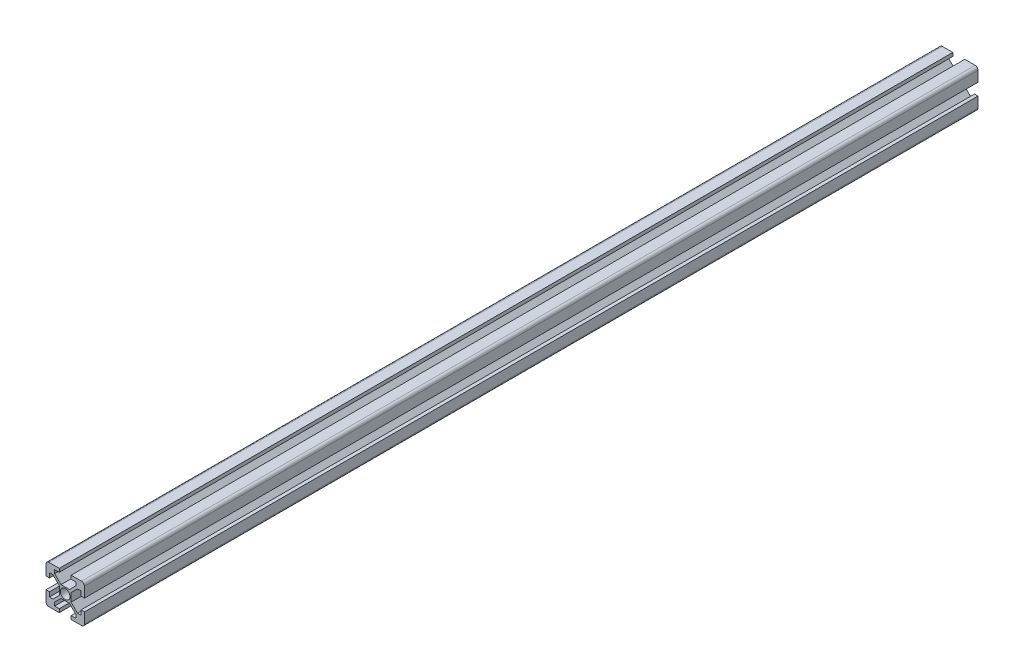
from build123d import *

# Parameters (mm, degrees)
SKETCH_1_R      = 2.5
EXTRUDE_1_DEPTH = 465


with BuildPart() as part:
    # 草图1 → 凸台-拉伸1 (new body)
    with BuildSketch(Plane.XY):
        with BuildLine():
            Line((-8.2, -3.1), (-10, -3.1))
            Line((-10, -3.1), (-10, -8.5))
            ThreePointArc((-10, -8.5), (-9.560660172, -9.560660172), (-8.5, -10))
            Line((-8.5, -10), (-3.1, -10))
            Line((-3.1, -10), (-3.1, -8.2))
            Line((-3.1, -8.2), (-5.5, -8.2))
            Line((-5.5, -8.2), (-5.5, -6.397050155))
            Line((-5.5, -6.397050155), (-2.202949845, -3.1))
            Line((-2.202949845, -3.1), (2.202949845, -3.1))
            Line((2.202949845, -3.1), (5.5, -6.397050155))
            Line((5.5, -6.397050155), (5.5, -8.2))
            Line((5.5, -8.2), (3.1, -8.2))
            Line((3.1, -8.2), (3.1, -10))
            Line((3.1, -10), (8.5, -10))
            ThreePointArc((8.5, -10), (9.560660172, -9.560660172), (10, -8.5))
            Line((10, -8.5), (10, -3.1))
            Line((10, -3.1), (8.2, -3.1))
            Line((8.2, -3.1), (8.2, -5.5))
            Line((8.2, -5.5), (6.397050155, -5.5))
            Line((6.397050155, -5.5), (3.05412702, -2.157076865))
            Line((3.05412702, -2.157076865), (3.05412702, 2.157076865))
            Line((3.05412702, 2.157076865), (6.397050155, 5.5))
            Line((6.397050155, 5.5), (8.2, 5.5))
            Line((8.2, 5.5), (8.2, 3.1))
            Line((8.2, 3.1), (10, 3.1))
            Line((10, 3.1), (10, 8.5))
            ThreePointArc((10, 8.5), (9.560660172, 9.560660172), (8.5, 10))
            Line((8.5, 10), (3.1, 10))
            Line((3.1, 10), (3.1, 8.2))
            Line((3.1, 8.2), (5.5, 8.2))
            Line((5.5, 8.2), (5.5, 6.397050155))
            Line((5.5, 6.397050155), (2.202949845, 3.1))
            Line((2.202949845, 3.1), (-2.202949845, 3.1))
            Line((-2.202949845, 3.1), (-5.5, 6.397050155))
            Line((-5.5, 6.397050155), (-5.5, 8.2))
            Line((-5.5, 8.2), (-3.1, 8.2))
            Line((-3.1, 8.2), (-3.1, 10))
            Line((-3.1, 10), (-8.5, 10))
            ThreePointArc((-8.5, 10), (-9.560660172, 9.560660172), (-10, 8.5))
            Line((-10, 8.5), (-10, 3.1))
            Line((-10, 3.1), (-8.2, 3.1))
            Line((-8.2, 3.1), (-8.2, 5.5))
            Line((-8.2, 5.5), (-6.397050155, 5.5))
            Line((-6.397050155, 5.5), (-3.05412702, 2.157076865))
            Line((-3.05412702, 2.157076865), (-3.05412702, -2.157076865))
            Line((-3.05412702, -2.157076865), (-6.397050155, -5.5))
            Line((-6.397050155, -5.5), (-8.2, -5.5))
            Line((-8.2, -5.5), (-8.2, -3.1))
        make_face()
        Circle(SKETCH_1_R, mode=Mode.SUBTRACT)
    extrude(amount=EXTRUDE_1_DEPTH)


solid = part.part
